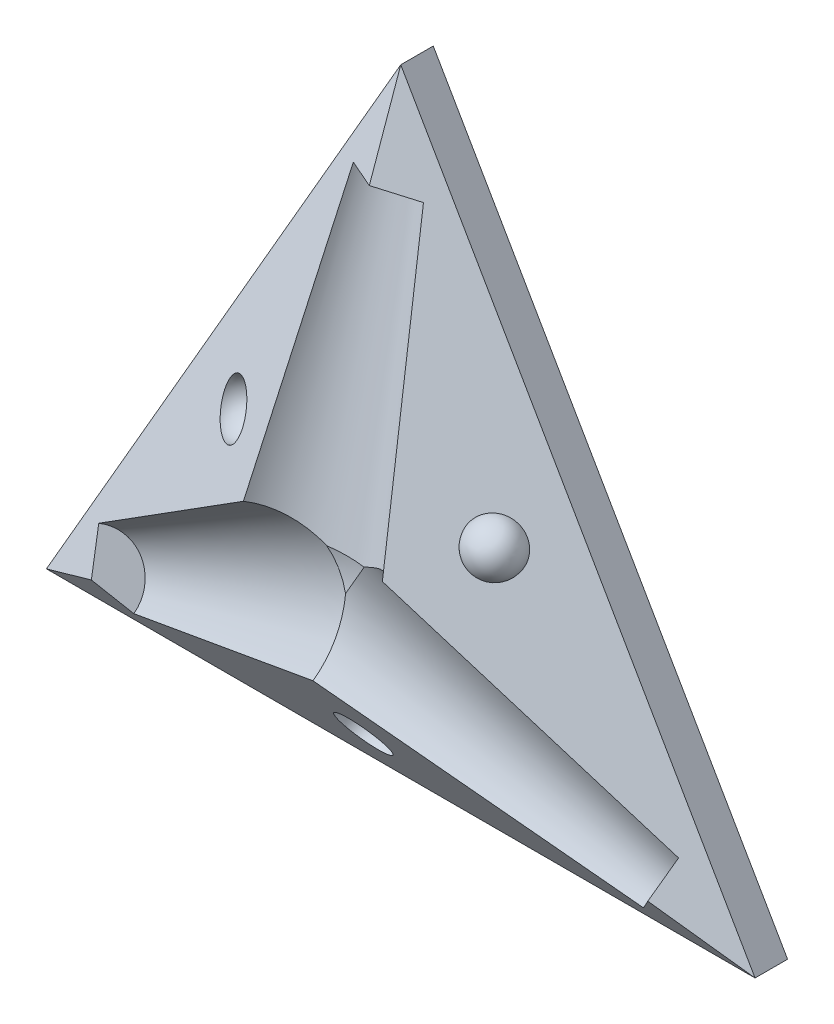
from build123d import *

# Parameters (mm, degrees)
BOSS_EXTRUDE1_DEPTH = 35
SKETCH17_W          = 133.012031184
SKETCH17_H          = 150.020262135
CUT_EXTRUDE1_DEPTH  = 100
SKETCH18_W          = 192.413181094
SKETCH18_H          = 151.943406229
CUT_EXTRUDE2_DEPTH  = 100
SKETCH19_W          = 213.02940575
SKETCH19_H          = 185.007600509
CUT_EXTRUDE3_DEPTH  = 100


with BuildPart() as part:
    # Sketch1 → Boss-Extrude1 (new body)
    with BuildSketch(Plane.XY):
        Polygon((0, 80.829037687), (-70, -40.414518843), (70, -40.414518843), align=None)
    extrude(amount=BOSS_EXTRUDE1_DEPTH)

    # Sketch17 → Cut-Extrude1 (cut)
    with BuildSketch(Plane(origin=(-14.288690166, 8.249579114, 23.333333333), x_dir=(0.8655579140838772, 0.1356024462386485, 0.4821011034429005), z_dir=(-0.5000000000000012, 0.2886751345948135, 0.8164965809277251))):
        with Locations((-15.800869145, 16.431717582)):
            Rectangle(SKETCH17_W, SKETCH17_H)
    extrude(amount=CUT_EXTRUDE1_DEPTH, mode=Mode.SUBTRACT)

    # Sketch18 → Cut-Extrude2 (cut)
    with BuildSketch(Plane(origin=(0, -16.499158228, 23.333333333), x_dir=(-0.9999855172716196, -0.004394333245699285, -0.003107262836822865), z_dir=(-3.769120432428607e-15, 0.577350269189629, -0.8164965809277238))):
        with Locations((-12.623056854, 9.892836606)):
            Rectangle(SKETCH18_W, SKETCH18_H)
    extrude(amount=-CUT_EXTRUDE2_DEPTH, mode=Mode.SUBTRACT)

    # Sketch19 → Cut-Extrude3 (cut)
    with BuildSketch(Plane(origin=(14.288690166, 8.249579114, 23.333333333), x_dir=(-0.8656985035271668, 0.1407013511718839, 0.48038446141526087), z_dir=(-0.4999999999999998, -0.288675134594816, -0.8164965809277251))):
        with Locations((-1.009116112, 24.341857859)):
            Rectangle(SKETCH19_W, SKETCH19_H)
    extrude(amount=-CUT_EXTRUDE3_DEPTH, mode=Mode.SUBTRACT)

    # Sketch2 → Cut-Revolve3 (revolve, cut)
    with BuildSketch(Plane.XY.offset(35)):
        with BuildLine():
            Line((18.146292999, 0), (-18.146292999, 0))
            ThreePointArc((-18.146292999, 0), (0, 18.146292999), (18.146292999, 0))
        make_face()
    revolve(axis=Axis((0, 0, 35), (1, 0, 0)), mode=Mode.SUBTRACT)

    # Sketch11 → Cut-Revolve7 (revolve, cut)
    with BuildSketch(Plane(origin=(-14.288690166, 8.249579114, 23.333333333), x_dir=(0.865557914083877, 0.13560244623864853, 0.48210110344290047), z_dir=(-0.5000000000000012, 0.2886751345948134, 0.816496580927725))):
        with BuildLine():
            ThreePointArc((0.3071152, -3.71281039), (6.752910141, 3.94358044), (16.277375636, 7.018177971))
            Line((16.277375636, 7.018177971), (14.668951259, 55.949737526))
            Line((14.668951259, 55.949737526), (6.673269744, 55.686912283))
            Line((6.673269744, 55.686912283), (0.3071152, -3.71281039))
        make_face()
    revolve(axis=Axis((0, 17.108489111, 28.951235667), (-2.185767015328875e-15, 0.9428090415820626, -0.33333333333333554)), mode=Mode.SUBTRACT)

    # Sketch3 → Cut-Revolve8 (revolve, cut)
    with BuildSketch(Plane(origin=(14.288690166, 8.249579114, 23.333333333), x_dir=(0.8656985035271669, -0.14070135117188398, -0.4803844614152608), z_dir=(0.4999999999999997, 0.28867513459481586, 0.8164965809277251))):
        with BuildLine():
            Line((45.996636443, -35.376806478), (48.869515746, -27.910444278))
            Line((48.869515746, -27.910444278), (-3.599712524, 1.228268839))
            ThreePointArc((-3.599712524, 1.228268839), (0.992741724, -7.712219863), (0.122393367, -17.725484464))
            Line((0.122393367, -17.725484464), (45.996636443, -35.376806478))
        make_face()
    revolve(axis=Axis((54.949625504, -31.725181077, 12.566909326), (-0.8164965809277288, 0.4714045207910254, 0.3333333333333354)), mode=Mode.SUBTRACT)

    # Sketch10 → Cut-Revolve9 (revolve, cut)
    with BuildSketch(Plane(origin=(0, -16.499158228, 23.333333333), x_dir=(0.9999855172716196, 0.004394333245699285, 0.00310726283682286), z_dir=(3.774324602856538e-15, -0.5773502691896293, 0.8164965809277237))):
        with BuildLine():
            Line((-14.763802711, 9.810092208), (-55.095676422, -18.384483489))
            Line((-55.095676422, -18.384483489), (-50.512095827, -24.941219638))
            Line((-50.512095827, -24.941219638), (3.05684637, 2.301752381))
            ThreePointArc((3.05684637, 2.301752381), (-6.936954181, 3.484349057), (-14.763802711, 9.810092208))
        make_face()
    revolve(axis=Axis((-14.81638619, -8.554244555, 28.951235667), (-0.8164965809277253, -0.471404520791033, -0.3333333333333334)), mode=Mode.SUBTRACT)

    # Sketch13 → Revolve2 (revolve)
    with BuildSketch(Plane(origin=(14.288690166, 8.249579114, 23.333333333), x_dir=(0.8656985035271668, -0.14070135117188393, -0.48038446141526087), z_dir=(0.49999999999999983, 0.2886751345948159, 0.8164965809277251))):
        with BuildLine():
            Line((9.570149417, 6.380099611), (17.89065236, 11.927101574))
            ThreePointArc((17.89065236, 11.927101574), (16.50390187, 4.993349121), (9.570149417, 6.380099611))
        make_face()
    revolve(axis=Axis((35, 20.207259422, 6.422619668), (-0.7071067811865586, -0.40824829046384215, 0.5773502691896272)))

    # Sketch14 → Cut-Revolve10 (revolve, cut)
    with BuildSketch(Plane(origin=(-14.288690166, 8.249579114, 23.333333333), x_dir=(0.865557914083877, 0.13560244623864853, 0.4821011034429005), z_dir=(-0.5000000000000013, 0.2886751345948133, 0.8164965809277251))):
        with BuildLine():
            Line((-7.635267484, 5.061697438), (-16.159640076, 10.663042982))
            ThreePointArc((-16.159640076, 10.663042982), (-14.698126552, 3.600183914), (-7.635267484, 5.061697438))
        make_face()
    revolve(axis=Axis((-35, 20.207259422, 6.422619668), (0.7077422098959172, -0.40714637457257147, 0.5773498021165807)), mode=Mode.SUBTRACT)

    # Sketch16 → Cut-Revolve11 (revolve, cut)
    with BuildSketch(Plane(origin=(0, -16.499158228, 23.333333333), x_dir=(1, 0, 0), z_dir=(3.774324602856538e-15, -0.577350269189629, 0.8164965809277237))):
        with BuildLine():
            Line((0, -21.601888146), (0, -11.401888146))
            ThreePointArc((0, -11.401888146), (5.1, -16.501888146), (0, -21.601888146))
        make_face()
    revolve(axis=Axis((0, -40.414518843, 6.422619668), (-2.2050404815138315e-15, 0.8164965809277238, 0.5773502691896291)), mode=Mode.SUBTRACT)


solid = part.part
